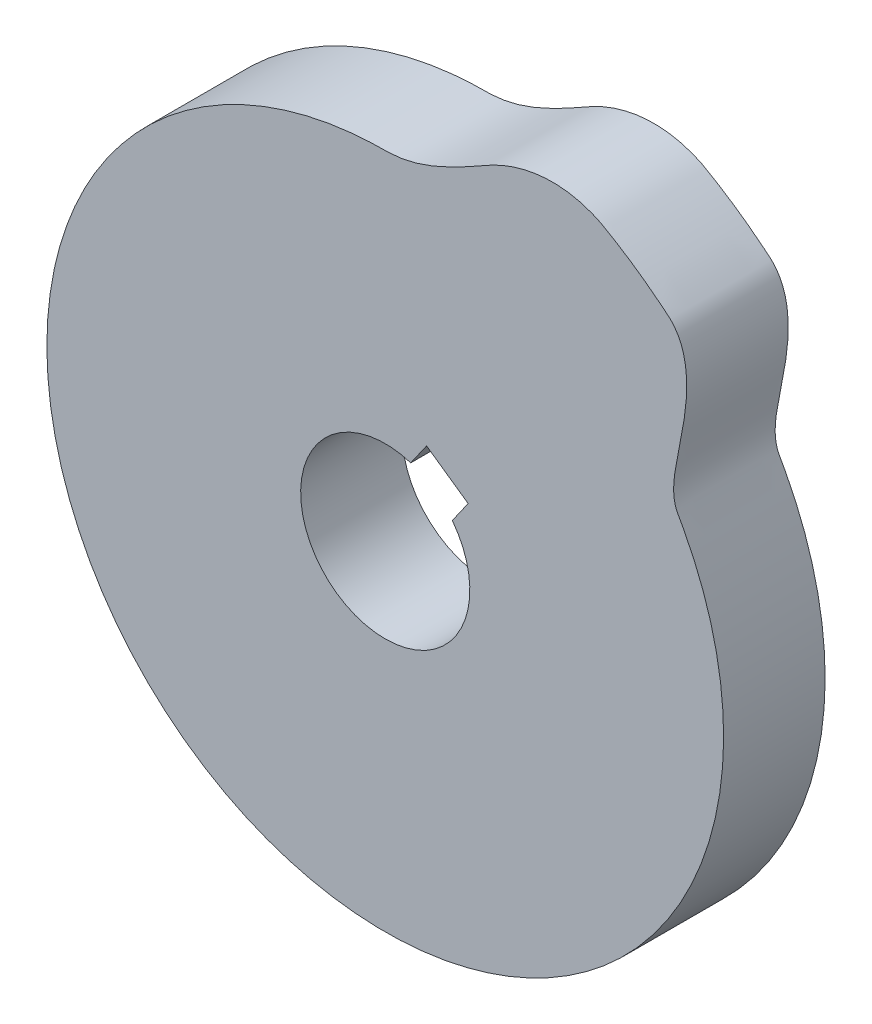
from build123d import *

# Parameters (mm, degrees)
EXTRUDE_1_DEPTH          = 12
CUT_EXTRUDE_1_DEPTH      = 12
CUT_EXTRUDE_1_DEPTH_BACK = 12


with BuildPart() as part:
    # 草图1 → 凸台-拉伸1 (new body)
    with BuildSketch(Plane.XY):
        with BuildLine():
            add(Edge.make_bspline(
                [(27.351788268, 44.225328473), (29.39386648, 42.962375934), (31.343721839, 41.561234748), (33.192019214, 40.028613022), (33.221934708, 40.003806876), (33.281710078, 39.954127511), (33.371206337, 39.879407198), (33.430758337, 39.829460293), (33.460506304, 39.804453493), (33.483034074, 39.78551615), (33.528057459, 39.747603216), (33.593003189, 39.687685579), (33.636038069, 39.647526241), (33.657373294, 39.627254796), (34.027631945, 39.275457349), (34.541053532, 38.608146608), (35.04573269, 37.545008456), (35.350871953, 36.568489885), (35.547339289, 35.511457659), (35.642808793, 34.388978409), (35.647131141, 33.217002122), (35.572402779, 32.012133499), (35.43277755, 30.791199231), (35.244214533, 29.570766504), (35.02411005, 28.366651151), (34.790856263, 27.193450564), (34.563350135, 26.064112634), (34.360474184, 24.989547194), (34.200624679, 23.978271724), (34.101245436, 23.036130031), (34.07886763, 22.166078343), (34.16092962, 21.226038136), (34.344332014, 20.59338553), (34.512190789, 20.243243376), (34.539306314, 20.186682209), (34.596562674, 20.075010215), (34.691620905, 19.912389166), (34.753814918, 19.803441193), (34.78478362, 19.748894362), (59.350458518, -23.519942371), (24.443197413, -58.976221612), (-19.203699823, -35.088714897), (-62.850597059, -11.201208181), (-51.801872093, 37.312607295), (-2.115452678, 39.94402158), (-1.660943976, 39.968092557), (-0.751104888, 40.000719438), (0.6197822, 39.98962427), (1.525796883, 40.089577117), (1.975010686, 40.162820075), (2.018710042, 40.169945124), (2.301798878, 40.217567372), (2.827578545, 40.323548342), (3.553332984, 40.508352574), (4.291705894, 40.733216445), (5.045243388, 40.997575809), (5.816486576, 41.300781593), (6.60796097, 41.642107559), (7.42217967, 42.020732861), (8.261599697, 42.435806358), (9.128769857, 42.886185917), (10.025722061, 43.371469606), (10.956377607, 43.887886577), (11.906056053, 44.438326185), (12.878800455, 44.968951621), (13.873860206, 45.424874026), (14.871101204, 45.811039471), (15.869002466, 46.124999364), (16.864086276, 46.367892076), (17.853404897, 46.54005247), (18.833899375, 46.64214907), (19.802569053, 46.674888677), (20.756430815, 46.639093046), (21.692533059, 46.535678403), (22.607956192, 46.365661842), (23.499814902, 46.130154781), (24.148629775, 45.905419588), (24.500615487, 45.764529159), (24.569314224, 45.736288636), (24.722514851, 45.673311267), (25.026310075, 45.541017025), (25.478652112, 45.331232046), (25.766666814, 45.167536106), (25.91027981, 45.085001942), (26.071968081, 44.992079947), (26.394344883, 44.80449637), (26.874917236, 44.51789708), (27.193183043, 44.323420148), (27.351788268, 44.225328473)],
                knots=[0, 0, 0, 0, 0.033655664, 0.033655664, 0.033655664, 0.034201266, 0.034746869, 0.035292471, 0.035292471, 0.035292471, 0.035705649, 0.036118826, 0.036532004, 0.036532004, 0.036532004, 0.043702431, 0.048242769, 0.053016241, 0.058046887, 0.063329599, 0.068834195, 0.074510414, 0.080292987, 0.086106514, 0.091870136, 0.097502108, 0.102924421, 0.10806767, 0.11287648, 0.117315843, 0.121378771, 0.125095144, 0.13054654, 0.13054654, 0.13054654, 0.131427147, 0.132307753, 0.133188359, 0.133188359, 0.133188359, 0.493311901, 0.493311901, 0.493311901, 0.853435443, 0.853435443, 0.853435443, 0.859825311, 0.86621518, 0.872605048, 0.872605048, 0.872605048, 0.873226652, 0.876635181, 0.880132556, 0.88373803, 0.887469259, 0.891342266, 0.895371485, 0.899569845, 0.903948895, 0.908518938, 0.913289174, 0.918267826, 0.923462273, 0.928702218, 0.933818705, 0.93881849, 0.943708661, 0.94849665, 0.95319024, 0.95779757, 0.962327131, 0.966787754, 0.971188597, 0.975539116, 0.979849031, 0.984128288, 0.985170954, 0.985170954, 0.985170954, 0.987496137, 0.98982132, 0.992146503, 0.992146503, 0.992146503, 0.994764335, 0.997382168, 1, 1, 1, 1], degree=3, weights=[1, 0.998404133, 0.998404133, 1, 1, 1, 1, 1, 1, 1, 1, 1, 1, 1, 1, 1, 1, 1, 1, 1, 1, 1, 1, 1, 1, 1, 1, 1, 1, 1, 1, 1, 1, 1, 1, 1, 1, 1, 1, 0.515542056, 0.515542056, 1, 0.515542056, 0.515542056, 1, 1, 1, 1, 1, 1, 1, 1, 1, 1, 1, 1, 1, 1, 1, 1, 1, 1, 1, 1, 1, 1, 1, 1, 1, 1, 1, 1, 1, 1, 1, 1, 1, 1, 1, 1, 1, 1, 1, 1, 1, 1, 1, 1, 1]))
        make_face()
    extrude(amount=EXTRUDE_1_DEPTH)

    # 草图2 → 切除-拉伸1 (cut, two sides: drawn at the far end of the back side and taken through both)
    with BuildSketch(Plane.XY.offset(-CUT_EXTRUDE_1_DEPTH_BACK)):
        with BuildLine():
            Line((3.014114344, 9.534941779), (4.884322225, 12.205875437))
            Line((4.884322225, 12.205875437), (9.799234491, 8.764416819))
            Line((9.799234491, 8.764416819), (7.929026609, 6.093483161))
            ThreePointArc((7.929026609, 6.093483161), (-5.735764364, -8.191520443), (3.014114344, 9.534941779))
        make_face()
    extrude(amount=CUT_EXTRUDE_1_DEPTH + CUT_EXTRUDE_1_DEPTH_BACK, mode=Mode.SUBTRACT)


solid = part.part
